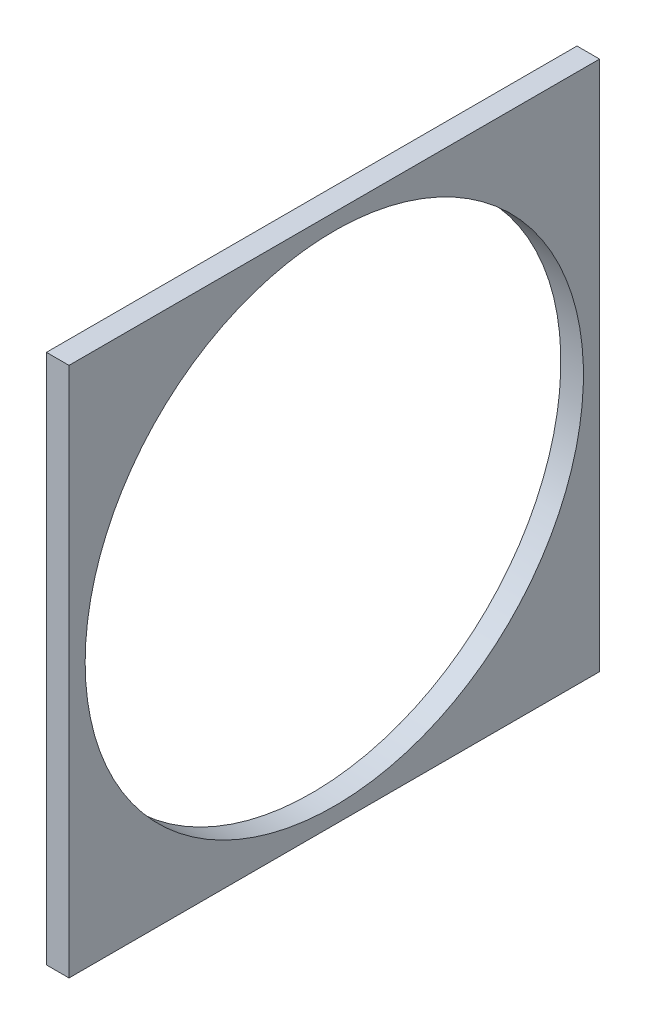
from build123d import *

# Parameters (mm, degrees)
SKETCH1_W           = 493.14
SKETCH1_H           = 493.14
SKETCH1_R           = 231.57
BOSS_EXTRUDE1_DEPTH = 21


with BuildPart() as part:
    # Sketch1 → Boss-Extrude1 (new body)
    with BuildSketch(Plane(origin=(0, 0, 0), x_dir=(0, 0, -1), z_dir=(1, 0, 0))):
        Rectangle(SKETCH1_W, SKETCH1_H)
        with Locations(Location((0, 0, 0), (0, 0, 180))):
            Circle(SKETCH1_R, mode=Mode.SUBTRACT)
    extrude(amount=BOSS_EXTRUDE1_DEPTH)


solid = part.part
